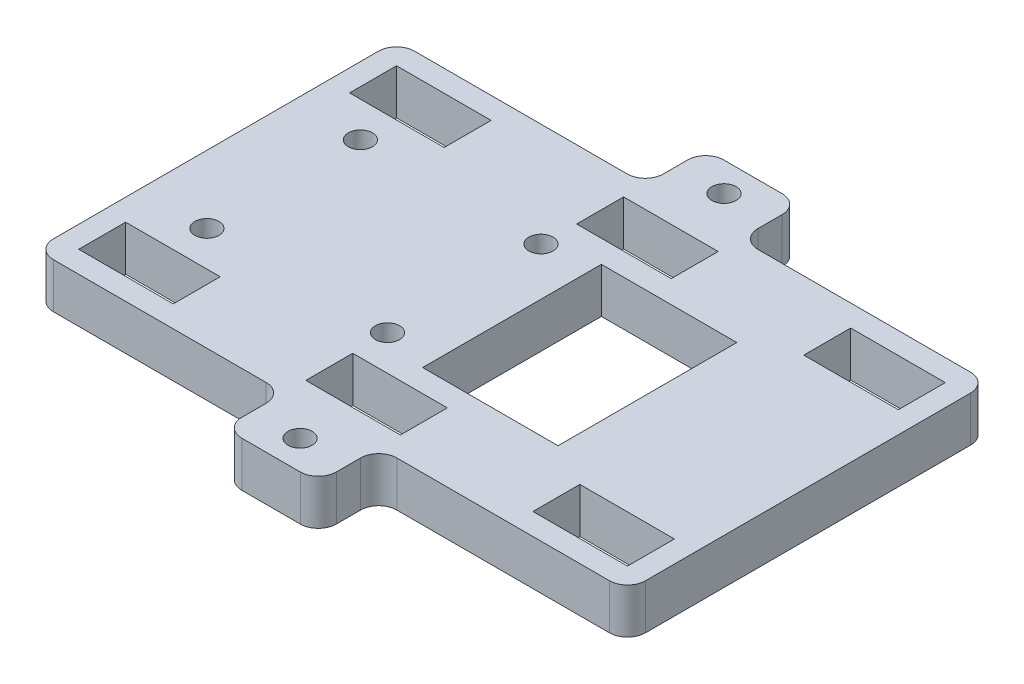
from build123d import *

# Parameters (mm, degrees)
SKETCH1_R           = 1.70053
SKETCH1_W           = 19.05
SKETCH1_H           = 25.146
SKETCH1_W_2         = 13.302551819
SKETCH1_H_2         = 6.604
BOSS_EXTRUDE1_DEPTH = 6.35
FILLET8_R           = 2.54


with BuildPart() as part:
    # Sketch1 → Boss-Extrude1 (new body)
    with BuildSketch(Plane(origin=(0, 0, 0), x_dir=(1, 0, 0), z_dir=(0, 1, 0))):
        Polygon((-25.233245497, -25.4), (-6.59007041, -25.4), (-6.59007041, -33.89757), (6.712481409, -33.89757), (6.712481409, -25.4), (25.355656497, -25.4), (38.658208316, -25.4), (41.7070455, -25.4), (41.7070455, 25.4), (38.658208316, 25.4), (25.355656497, 25.4), (6.712481409, 25.4), (6.712481409, 33.89757), (-6.59007041, 33.89757), (-6.59007041, 25.4), (-25.233245497, 25.4), (-38.535797316, 25.4), (-41.5846345, 25.4), (-41.5846345, -25.4), (-38.535797316, -25.4), align=None)
        with Locations(Location((-32.0583645, 10.795, 0), (0, 0, 270))):
            Circle(SKETCH1_R, mode=Mode.SUBTRACT)
        with Locations(Location((-32.0583645, -10.795, 0), (0, 0, 270))):
            Circle(SKETCH1_R, mode=Mode.SUBTRACT)
        with Locations(Location((-6.6583645, -10.795, 0), (0, 0, 270))):
            Circle(SKETCH1_R, mode=Mode.SUBTRACT)
        with Locations(Location((-6.6583645, 10.795, 0), (0, 0, 270))):
            Circle(SKETCH1_R, mode=Mode.SUBTRACT)
        with Locations(Location((0.0612055, -29.81452, 0), (0, 0, 270))):
            Circle(SKETCH1_R, mode=Mode.SUBTRACT)
        with Locations(Location((0.0612055, 29.81452, 0), (0, 0, 270))):
            Circle(SKETCH1_R, mode=Mode.SUBTRACT)
        Polygon((38.658208316, 15.748), (38.658208316, 22.225), (38.658208316, 22.352), (25.355656497, 22.352), (25.355656497, 15.748), align=None, mode=Mode.SUBTRACT)
        with Locations((9.5862055, 0)):
            Rectangle(SKETCH1_W, SKETCH1_H, mode=Mode.SUBTRACT)
        with Locations((0.0612055, -19.05)):
            Rectangle(SKETCH1_W_2, SKETCH1_H_2, mode=Mode.SUBTRACT)
        with Locations((0.0612055, 19.05)):
            Rectangle(SKETCH1_W_2, SKETCH1_H_2, mode=Mode.SUBTRACT)
        Polygon((-38.535797316, 22.352), (-25.233245497, 22.352), (-25.233245497, 22.225), (-25.233245497, 15.748), (-38.535797316, 15.748), align=None, mode=Mode.SUBTRACT)
        with Locations((-31.884521406, -19.05)):
            Rectangle(SKETCH1_W_2, SKETCH1_H_2, mode=Mode.SUBTRACT)
        with Locations((32.006932406, -19.05)):
            Rectangle(SKETCH1_W_2, SKETCH1_H_2, mode=Mode.SUBTRACT)
    extrude(amount=BOSS_EXTRUDE1_DEPTH)

    # Fillet8
    fillet8_edges = [part.edges().sort_by_distance(p)[0] for p in [
        (-6.59007041, 3.175, -25.4),
        (-6.59007041, 3.175, -33.89757),
        (6.712481409, 3.175, -33.89757),
        (6.712481409, 3.175, -25.4),
        (41.7070455, 3.175, -25.4),
        (41.7070455, 3.175, 25.4),
        (6.712481409, 3.175, 25.4),
        (6.712481409, 3.175, 33.89757),
        (-6.59007041, 3.175, 33.89757),
        (-6.59007041, 3.175, 25.4),
        (-41.5846345, 3.175, 25.4),
        (-41.5846345, 3.175, -25.4),
    ]]
    fillet(fillet8_edges, radius=FILLET8_R)


solid = part.part
